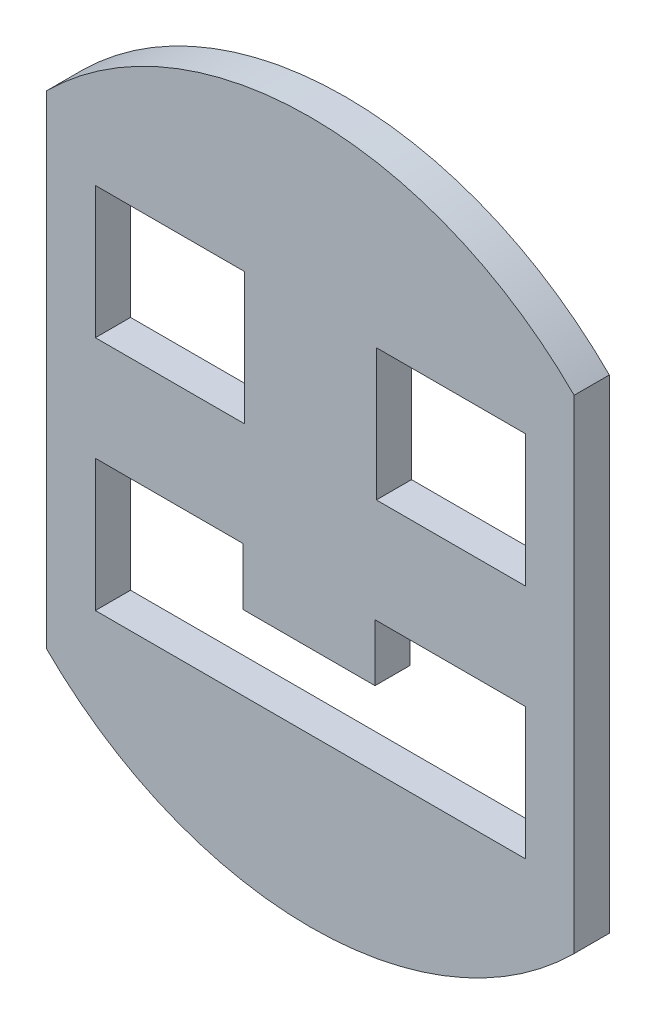
from build123d import *

# Parameters (mm, degrees)
RESSALTO_EXTRUS_O1_DEPTH = 8
CORTE_EXTRUS_O1_DEPTH    = 10
RESSALTO_EXTRUS_O2_REACH = 161.117
ESBO_O3_W                = 30
ESBO_O3_H                = 8
ESBO_O4_R                = 2.5
CORTE_EXTRUS_O2_DEPTH    = 3


with BuildPart() as part:
    # Esboço1 → Ressalto-extrusão1 (new body)
    with BuildSketch(Plane.XY):
        with BuildLine():
            Line((0, 0), (0, -110))
            ThreePointArc((0, -110), (60, -134.792027106), (120, -110))
            Line((120, -110), (120, 0))
            ThreePointArc((120, 0), (60, 24.792027106), (0, 0))
        make_face()
    extrude(amount=RESSALTO_EXTRUS_O1_DEPTH)

    # Esboço2 → Corte-extrusão1 (cut)
    with BuildSketch(Plane(origin=(0, 0, 0), x_dir=(-1, 0, 0), z_dir=(0, 0, -1))):
        Polygon((-108.919644627, -96.875), (-11.080355373, -96.875), (-11.080355373, -66.875), (-44.695581191, -66.875), (-44.695581191, -79.875), (-74.695581191, -79.875), (-74.695581191, -66.875), (-108.919644627, -66.875), align=None)
        Polygon((-108.919644627, -43.125), (-75, -43.125), (-75, -30.608967116), (-45, -30.608967116), (-45, -43.125), (-11.080355373, -43.125), (-11.080355373, -13.125), (-108.919644627, -13.125), align=None)
    extrude(amount=-CORTE_EXTRUS_O1_DEPTH, mode=Mode.SUBTRACT)

    # Esboço3 → Ressalto-extrusão2 (add, up to next)
    with BuildSketch(Plane(origin=(0, -30.608967116, 0), x_dir=(1, 0, 0), z_dir=(0, 1, 0)), mode=Mode.PRIVATE) as ressalto_extrus_o2_sk1:
        with Locations((60, -4)):
            Rectangle(ESBO_O3_W, ESBO_O3_H)
    ressalto_extrus_o2_tool1 = extrude(ressalto_extrus_o2_sk1.sketch, amount=RESSALTO_EXTRUS_O2_REACH, mode=Mode.PRIVATE) - part.part
    add(ressalto_extrus_o2_tool1.solids().sort_by_distance((60, -30.608967, 4))[0])

    # Esboço4 → Corte-extrusão2 (cut)
    with BuildSketch(Plane(origin=(0, 0, 0), x_dir=(-1, 0, 0), z_dir=(0, 0, -1))):
        with Locations((-18.70841508, -1.064839346)):
            Circle(ESBO_O4_R)
        with Locations((-6.09375, -34.065)):
            Circle(ESBO_O4_R)
        with Locations((-6.09375, -75.94)):
            Circle(ESBO_O4_R)
        with Locations((-18.70841508, -117.382967977)):
            Circle(ESBO_O4_R)
        with Locations((-60, -129.382503442)):
            Circle(ESBO_O4_R)
        with Locations((-101.29158492, -117.382967977)):
            Circle(ESBO_O4_R)
        with Locations((-113.90625, -75.94)):
            Circle(ESBO_O4_R)
        with Locations((-113.90625, -34.065)):
            Circle(ESBO_O4_R)
        with Locations((-101.29158492, -1.064839346)):
            Circle(ESBO_O4_R)
    extrude(amount=-CORTE_EXTRUS_O2_DEPTH, mode=Mode.SUBTRACT)


solid = part.part
